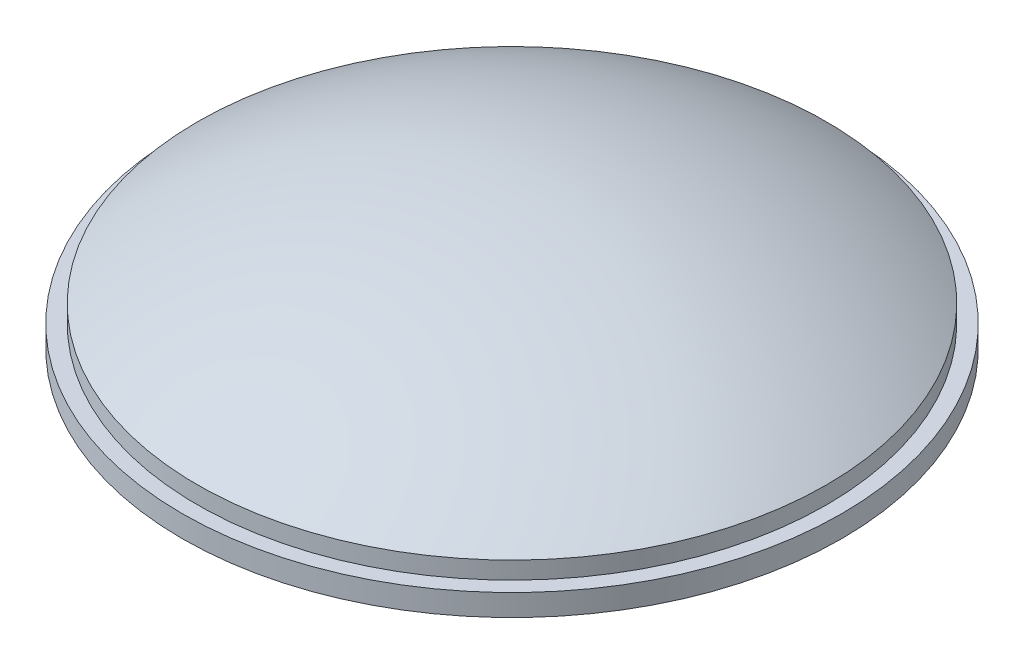
from build123d import *

# Parameters (mm, degrees)
SKETCH2_W          = 70
SKETCH2_H          = 180
CUT_EXTRUDE1_DEPTH = 25


with BuildPart() as part:
    # Sketch1 → Revolve1 (revolve)
    with BuildSketch(Plane.XY, mode=Mode.PRIVATE) as revolve1_sk:
        with BuildLine():
            Line((72.5, 40), (72.5, 36))
            Line((72.5, 36), (76, 36))
            Line((76, 36), (76, 31))
            Line((76, 31), (73, 31))
            Line((73, 31), (67, 25))
            Line((67, 25), (51, 25))
            Line((51, 25), (26, 0))
            Line((26, 0), (0, 0))
            Line((0, 0), (0, 62.2))
            ThreePointArc((0, 62.2), (37.91137692, 56.525667871), (72.5, 40))
        make_face()
    revolve(revolve1_sk.sketch.rotate(Axis((0, 0, 0), (0, -1, 0)), 180), axis=Axis((0, 0, 0), (0, -1, 0)))

    # Sketch2 → Cut-Extrude1 (cut)
    with BuildSketch(Plane.XZ):
        with Locations((65, 0)):
            Rectangle(SKETCH2_W, SKETCH2_H)
    extrude(amount=-CUT_EXTRUDE1_DEPTH, mode=Mode.SUBTRACT)


solid = part.part
